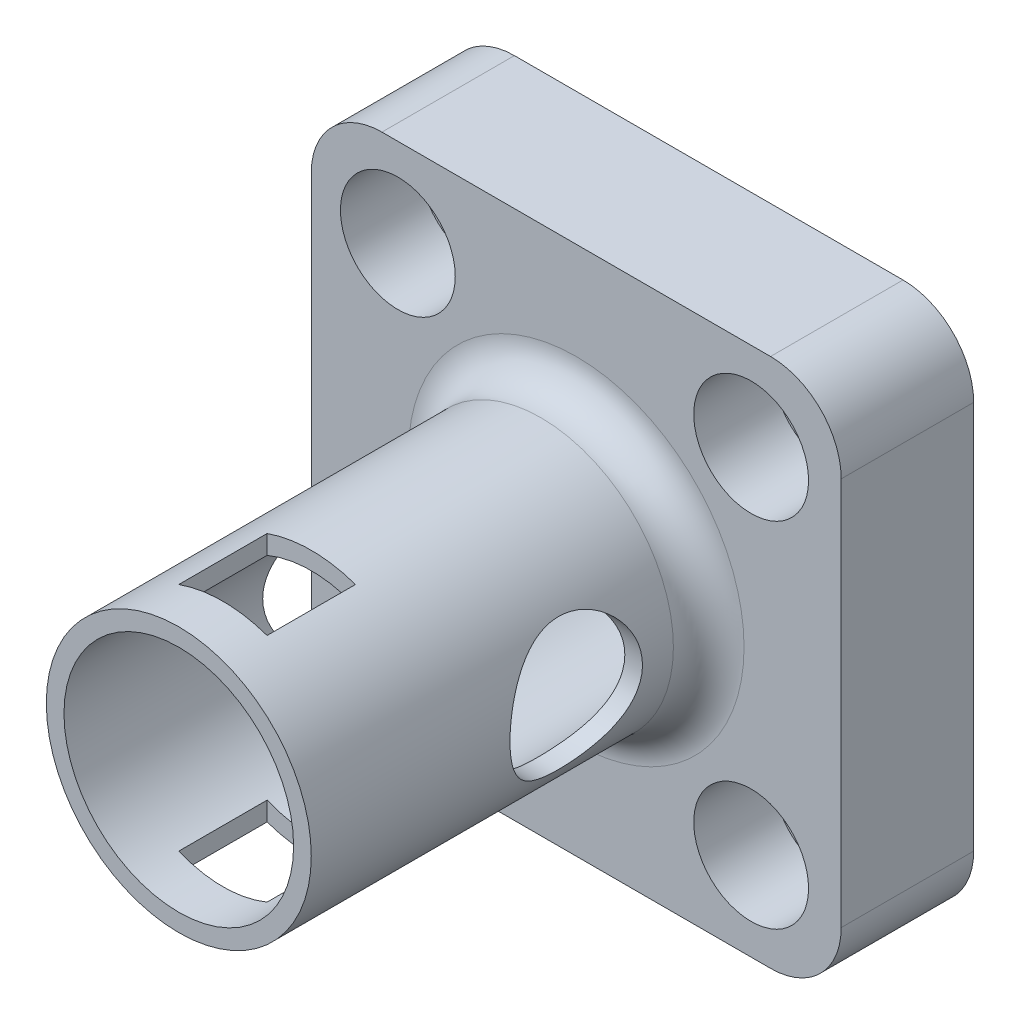
from build123d import *

# Parameters (mm, degrees)
ESBO_O1_W                = 60
ESBO_O1_H                = 15
RESSALTO_EXTRUS_O1_DEPTH = 60
ESBO_O4_R                = 6.5
CORTE_EXTRUS_O1_DEPTH    = 9
ESBO_O5_R                = 4.5
CORTE_EXTRUS_O2_DEPTH    = 6
ESBO_O6_R                = 15
RESSALTO_EXTRUS_O3_DEPTH = 45
ESBO_O7_R                = 13
CORTE_EXTRUS_O3_DEPTH    = 104.923048454
FILETE2_R                = 4
ESBO_O8_R                = 7.5
CORTE_EXTRUS_O10_DEPTH   = 104.923048454
ESBO_O9_W                = 10
ESBO_O9_H                = 10
CORTE_EXTRUS_O11_DEPTH   = 104.923048512
FILETE3_R                = 8


with BuildPart() as part:
    # Esboço1 → Ressalto-extrusão1 (new body)
    with BuildSketch(Plane(origin=(0, 0, 0), x_dir=(1, 0, 0), z_dir=(0, 1, 0))):
        with Locations((30, -7.5)):
            Rectangle(ESBO_O1_W, ESBO_O1_H)
    extrude(amount=RESSALTO_EXTRUS_O1_DEPTH)

    # Esboço4 → Corte-extrusão1 (cut)
    with BuildSketch(Plane.XY.offset(15)):
        with Locations((9.802292797, 50)):
            Circle(ESBO_O4_R)
        with Locations((49.802292797, 50)):
            Circle(ESBO_O4_R)
        with Locations((9.802292797, 10)):
            Circle(ESBO_O4_R)
        with Locations((49.802292797, 10)):
            Circle(ESBO_O4_R)
    extrude(amount=-CORTE_EXTRUS_O1_DEPTH, mode=Mode.SUBTRACT)

    # Esboço5 → Corte-extrusão2 (cut)
    with BuildSketch(Plane(origin=(0, 0, 0), x_dir=(-1, 0, 0), z_dir=(0, 0, -1))):
        with Locations((-50, 50)):
            Circle(ESBO_O5_R)
        with Locations((-10, 50)):
            Circle(ESBO_O5_R)
        with Locations((-50, 10)):
            Circle(ESBO_O5_R)
        with Locations((-10, 10)):
            Circle(ESBO_O5_R)
    extrude(amount=-CORTE_EXTRUS_O2_DEPTH, mode=Mode.SUBTRACT)

    # Esboço6 → Ressalto-extrusão3 (add)
    with BuildSketch(Plane.XY.offset(15)):
        with Locations(Location((30, 30, 0), (0, 0, 180))):
            Circle(ESBO_O6_R)
    extrude(amount=RESSALTO_EXTRUS_O3_DEPTH)

    # Esboço7 → Corte-extrusão3 (cut, through all)
    with BuildSketch(Plane.XY.offset(60)):
        with Locations((30, 30)):
            Circle(ESBO_O7_R)
    extrude(amount=-CORTE_EXTRUS_O3_DEPTH, mode=Mode.SUBTRACT)

    # Filete2
    filete2_edges = [part.edges().sort_by_distance(p)[0] for p in [
        (45, 30, 15),
    ]]
    fillet(filete2_edges, radius=FILETE2_R)

    # Esboço8 → Corte-extrusão10 (cut, through all)
    with BuildSketch(Plane(origin=(0, 0, 0), x_dir=(0, 0, -1), z_dir=(1, 0, 0))):
        with Locations(Location((-30, 30, 0), (0, 0, 180))):
            Circle(ESBO_O8_R)
    extrude(amount=CORTE_EXTRUS_O10_DEPTH, mode=Mode.SUBTRACT)

    # Esboço9 → Corte-extrusão11 (cut, through all)
    with BuildSketch(Plane(origin=(0, 0, 0), x_dir=(1, 0, 0), z_dir=(0, 1, 0))):
        with Locations((30, -50)):
            Rectangle(ESBO_O9_W, ESBO_O9_H)
    extrude(amount=CORTE_EXTRUS_O11_DEPTH, mode=Mode.SUBTRACT)

    # Filete3
    filete3_edges = [part.edges().sort_by_distance(p)[0] for p in [
        (60, 60, 7.5),
        (60, 0, 7.5),
        (0, 0, 7.5),
        (0, 60, 7.5),
    ]]
    fillet(filete3_edges, radius=FILETE3_R)


solid = part.part
